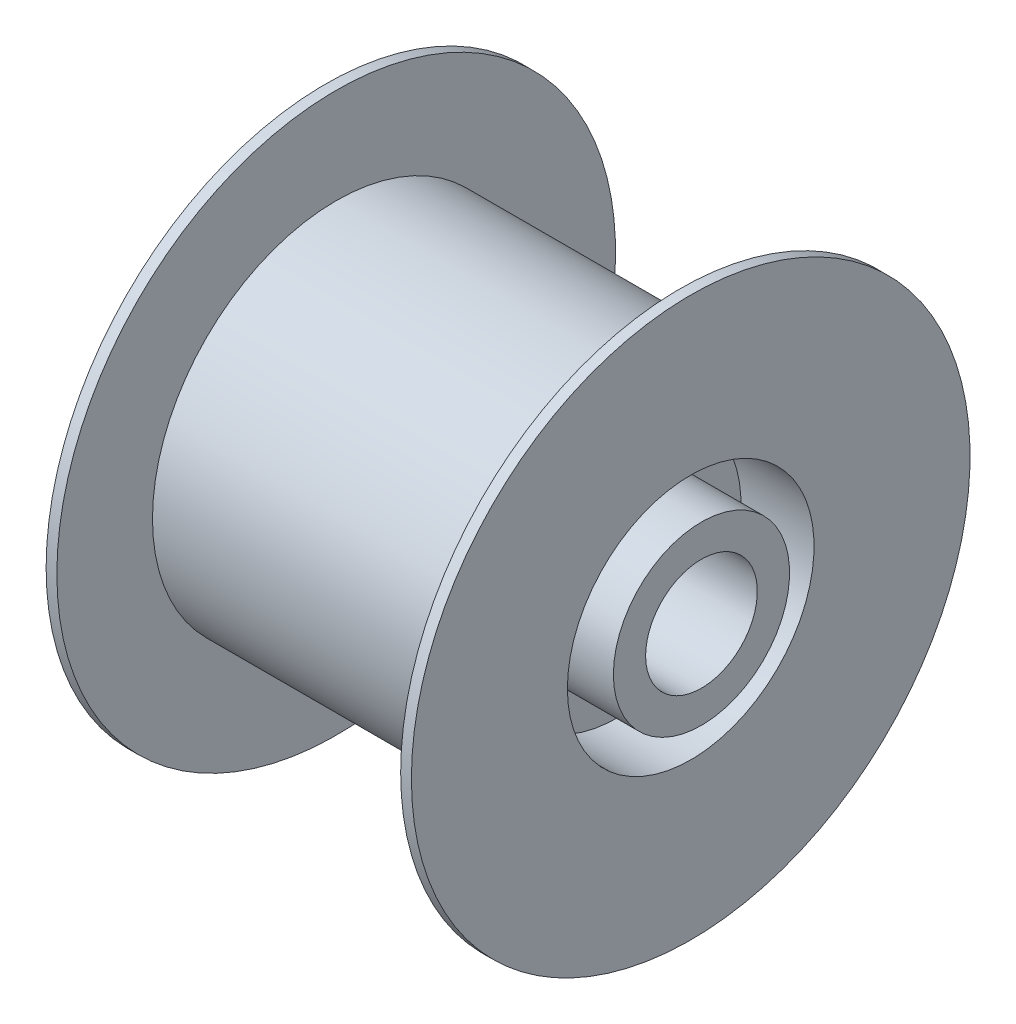
from build123d import *


with BuildPart() as part:
    # Sketch1 → Revolve1 (revolve)
    with BuildSketch(Plane.XY, mode=Mode.PRIVATE) as revolve1_sk:
        Polygon((0, 4.1), (0, 2.6), (18, 2.6), (18, 4.1), (14.1, 4.1), (14.1, 5.74), (17.5, 5.74), (17.5, 13), (17, 13), (17, 8.55), (1, 8.55), (1, 13), (0.5, 13), (0.5, 5.74), (3.9, 5.74), (3.9, 4.1), align=None)
    revolve(revolve1_sk.sketch.rotate(Axis((0, 0, 0), (1, 0, 0)), 90), axis=Axis((0, 0, 0), (1, 0, 0)))


solid = part.part
